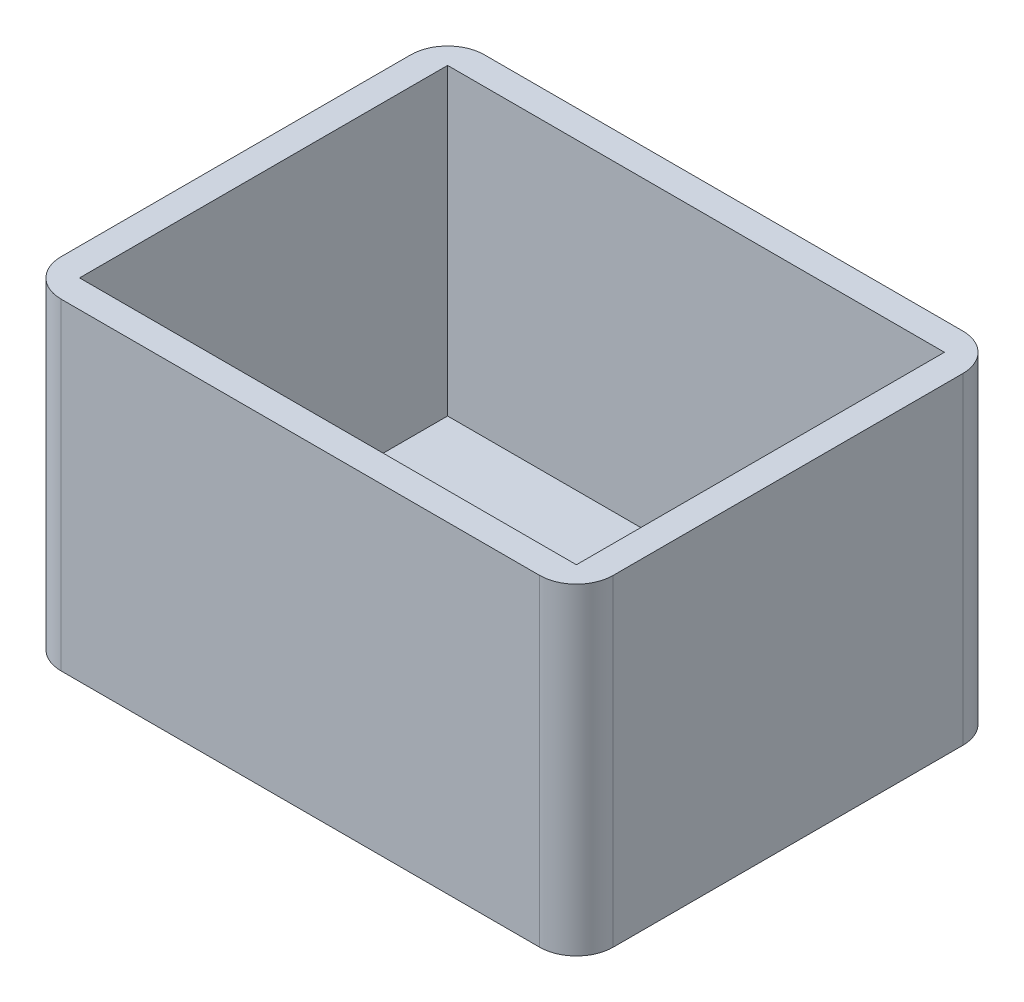
from build123d import *

# Parameters (mm, degrees)
ESQUISSE1_W         = 54
ESQUISSE1_H         = 40
BOSS_EXTRU_9_DEPTH  = 2
ESQUISSE1_14_W      = 60
ESQUISSE1_14_H      = 46
ESQUISSE1_14_W_2    = 54
ESQUISSE1_14_H_2    = 40
BOSS_EXTRU_10_DEPTH = 35
CONG_14_R           = 4
ESQUISSE1_18_W      = 10
ESQUISSE1_18_H      = 24
BOSS_EXTRU_12_DEPTH = 2
ESQUISSE1_20_W      = 10
ESQUISSE1_20_H      = 2
BOSS_EXTRU_13_DEPTH = 2
BOSS_EXTRU_15_START = -2
ESQUISSE9_W         = 10
ESQUISSE9_H         = 24
BOSS_EXTRU_15_DEPTH = 2
CONG_15_R           = 2


with BuildPart() as part:
    # Esquisse1 → Boss.-Extru.9 (new body)
    with BuildSketch(Plane(origin=(0, 0, 0), x_dir=(1, 0, 0), z_dir=(0, 1, 0))):
        with Locations((30, 23)):
            Rectangle(ESQUISSE1_W, ESQUISSE1_H)
        Polygon((35, 33), (35, 13), (35, 11), (25, 11), (25, 13), (25, 33), (25, 35), (35, 35), align=None, mode=Mode.SUBTRACT)
    extrude(amount=BOSS_EXTRU_9_DEPTH)

    # Esquisse1<14> → Boss.-Extru.10 (add)
    with BuildSketch(Plane(origin=(0, 0, 0), x_dir=(1, 0, 0), z_dir=(0, 1, 0))):
        with Locations((30, 23)):
            Rectangle(ESQUISSE1_14_W, ESQUISSE1_14_H)
        with Locations((30, 23)):
            Rectangle(ESQUISSE1_14_W_2, ESQUISSE1_14_H_2, mode=Mode.SUBTRACT)
    extrude(amount=BOSS_EXTRU_10_DEPTH)

    # Congé14
    cong_14_edges = [part.edges().sort_by_distance(p)[0] for p in [
        (60, 17.5, 0),
        (60, 17.5, -46),
        (0, 17.5, -46),
        (0, 17.5, 0),
    ]]
    fillet(cong_14_edges, radius=CONG_14_R)

    # Esquisse1<18> → Boss.-Extru.12 (add)
    with BuildSketch(Plane(origin=(0, 0, 0), x_dir=(1, 0, 0), z_dir=(0, 1, 0))):
        with Locations((30, 23)):
            Rectangle(ESQUISSE1_18_W, ESQUISSE1_18_H)
    extrude(amount=BOSS_EXTRU_12_DEPTH)

    # Esquisse1<20> → Boss.-Extru.13 (add)
    with BuildSketch(Plane(origin=(0, 0, 0), x_dir=(1, 0, 0), z_dir=(0, 1, 0))):
        with Locations((30, 12)):
            Rectangle(ESQUISSE1_20_W, ESQUISSE1_20_H)
        with Locations((30, 34)):
            Rectangle(ESQUISSE1_20_W, ESQUISSE1_20_H)
    extrude(amount=-BOSS_EXTRU_13_DEPTH)

    # Esquisse9 → Boss.-Extru.15 (add)
    with BuildSketch(Plane(origin=(0, 0, 0), x_dir=(1, 0, 0), z_dir=(0, 1, 0)).offset(BOSS_EXTRU_15_START)):
        with Locations((30, 23)):
            Rectangle(ESQUISSE9_W, ESQUISSE9_H)
    extrude(amount=-BOSS_EXTRU_15_DEPTH)

    # Congé15
    cong_15_edges = [part.edges().sort_by_distance(p)[0] for p in [
        (30, -4, -35),
        (30, -4, -11),
    ]]
    fillet(cong_15_edges, radius=CONG_15_R)


solid = part.part
